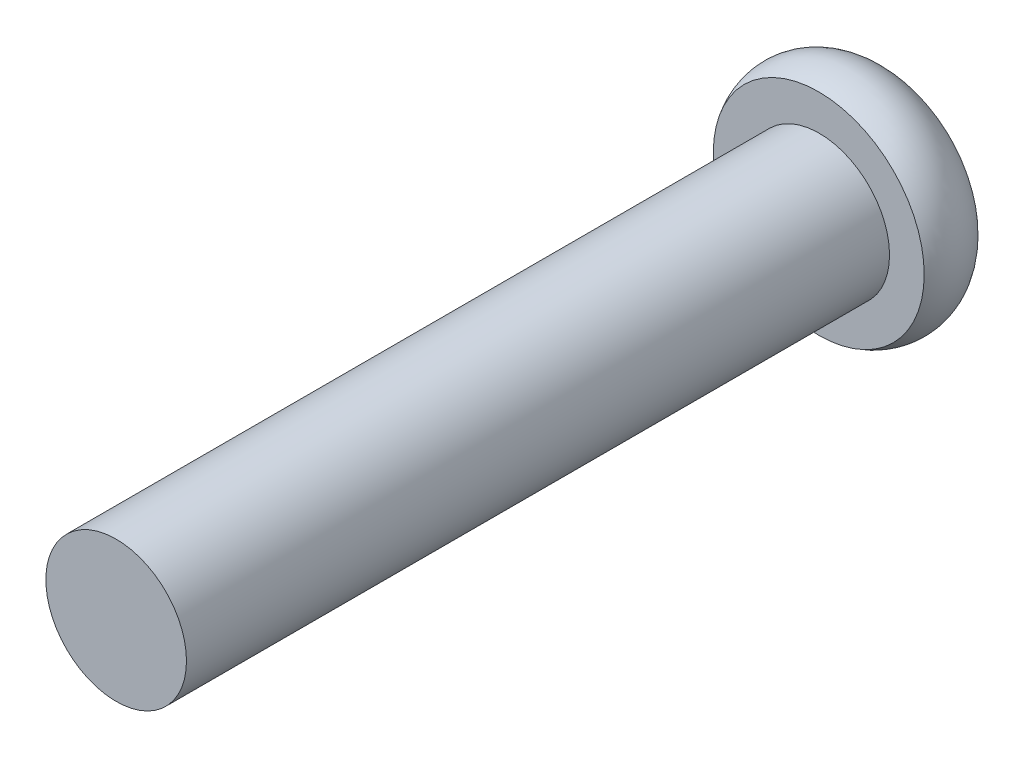
from build123d import *

# Parameters (mm, degrees)
CUT_EXTRUDE1_DEPTH  = 2
CUT_EXTRUDE1_DRAFT  = -12
SKETCH3_R           = 2
BOSS_EXTRUDE1_DEPTH = 20


with BuildPart() as part:
    # Sketch1 → Revolve2 (revolve)
    with BuildSketch(Plane(origin=(0, 0, 0), x_dir=(1, 0, 0), z_dir=(0, 1, 0))):
        with BuildLine():
            Line((0, 0), (0, 2))
            Line((0, 2), (2.298285661, 2))
            ThreePointArc((2.298285661, 2), (2.441964308, 1.978911731), (2.57352322, 1.917425786))
            ThreePointArc((2.57352322, 1.917425786), (3.174697589, 1.044998208), (3, 0))
            Line((3, 0), (0, 0))
        make_face()
    revolve(axis=Axis((0, 0, -0.65925001), (0, 0, -1)))


with BuildPart() as cut_extrude1_tool:
    # Sketch2 → Cut-Extrude1 (with draft: the straight prism first)
    with BuildSketch(Plane(origin=(0, 0, -2), x_dir=(-1, 0, 0), z_dir=(0, 0, -1))):
        Polygon((0.5, -0.5), (2, -0.5), (2, 0.5), (0.5, 0.5), (0.5, 2), (-0.5, 2), (-0.5, 0.5), (-2, 0.5), (-2, -0.5), (-0.5, -0.5), (-0.5, -2), (0.5, -2), align=None)
    extrude(amount=-CUT_EXTRUDE1_DEPTH)
    # Cut-Extrude1: the draft: its side faces are tilted about the plane it starts from
    cut_extrude1_sides = [cut_extrude1_tool.faces().sort_by_distance(p)[0] for p in [
        (-1.25, -0.5, -1),
        (-2, 0, -1),
        (-1.25, 0.5, -1),
        (-0.5, 1.25, -1),
        (0, 2, -1),
        (0.5, 1.25, -1),
        (1.25, 0.5, -1),
        (2, 0, -1),
        (1.25, -0.5, -1),
        (0.5, -1.25, -1),
        (0, -2, -1),
        (-0.5, -1.25, -1),
    ]]
    draft(cut_extrude1_sides, Plane(origin=(0, 0, -2), x_dir=(-1, 0, 0), z_dir=(0, 0, -1)), CUT_EXTRUDE1_DRAFT)


with BuildPart() as part_1:
    add(part.part)

    # Cut-Extrude1: cut by cut_extrude1_tool
    add(cut_extrude1_tool.part, mode=Mode.SUBTRACT)

    # Sketch3 → Boss-Extrude1 (add)
    with BuildSketch(Plane.XY):
        with Locations((0.013589602, -0.013589602)):
            Circle(SKETCH3_R)
    extrude(amount=BOSS_EXTRUDE1_DEPTH)


solid = part_1.part
